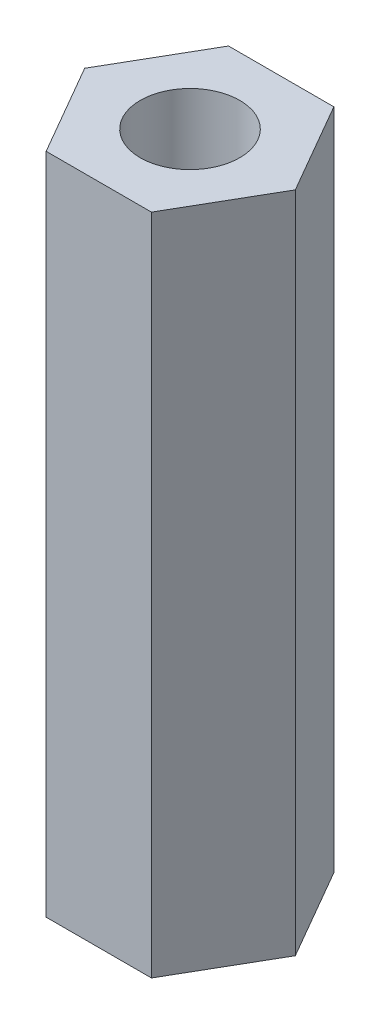
from build123d import *

# Parameters (mm, degrees)
BOSS_EXTRUDE1_DEPTH = 20
SKETCH2_R           = 1.5
CUT_EXTRUDE1_DEPTH  = 10


with BuildPart() as part:
    # Sketch1 → Boss-Extrude1 (new body)
    with BuildSketch(Plane(origin=(0, 0, 0), x_dir=(1, 0, 0), z_dir=(0, 1, 0))):
        Polygon((3.175426481, 0), (1.58771324, 2.75), (-1.58771324, 2.75), (-3.175426481, 0), (-1.58771324, -2.75), (1.58771324, -2.75), align=None)
    extrude(amount=BOSS_EXTRUDE1_DEPTH)

    # Sketch2 → Cut-Extrude1 (cut)
    with BuildSketch(Plane(origin=(0, 20, 0), x_dir=(1, 0, 0), z_dir=(0, 1, 0))):
        with Locations(Location((0, 0, 0), (0, 0, 270))):
            Circle(SKETCH2_R)
    cut_extrude1 = extrude(amount=-CUT_EXTRUDE1_DEPTH, mode=Mode.SUBTRACT)

    # Mirror1: Cut-Extrude1 across plane
    add(cut_extrude1.mirror(Plane(origin=(0, 10, 0), x_dir=(0, 0, 1), z_dir=(0, -1, 0))), mode=Mode.SUBTRACT)


solid = part.part
